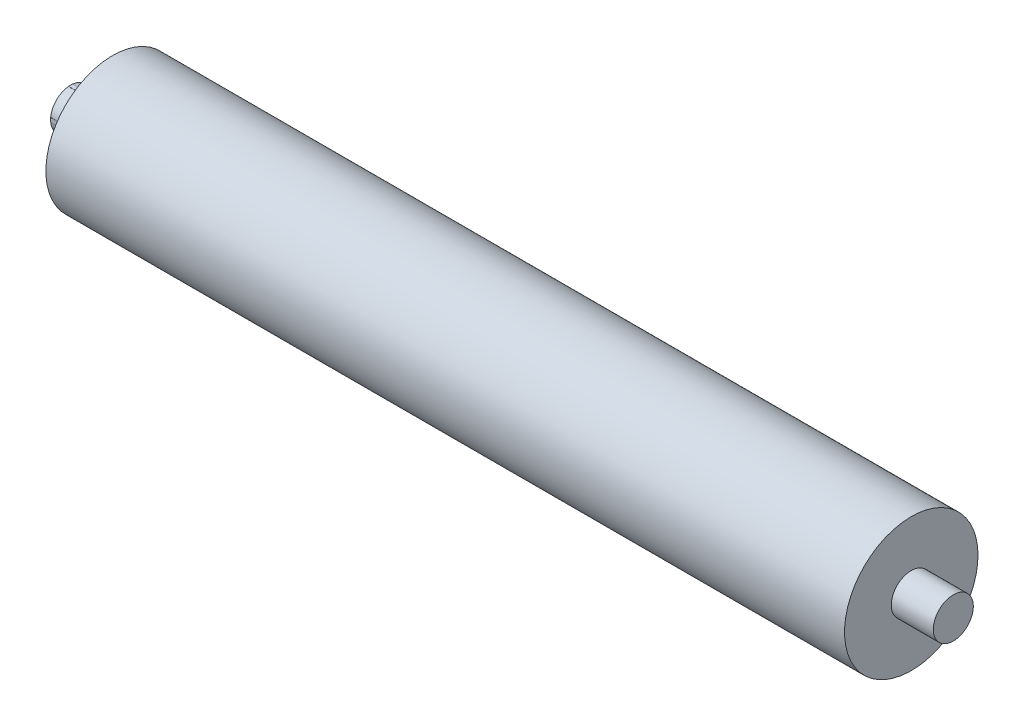
from build123d import *

# Parameters (mm, degrees)
CROQUIS1_R              = 9.525
SALIENTE_EXTRUIR1_DEPTH = 20
CROQUIS2_R              = 31.75
SALIENTE_EXTRUIR2_DEPTH = 380
CROQUIS3_R              = 9.525
SALIENTE_EXTRUIR3_DEPTH = 20
SALIENTE_EXTRUIR4_DEPTH = 20


with BuildPart() as part:
    # Croquis1 → Saliente-Extruir1 (new body)
    with BuildSketch(Plane(origin=(0, 0, 0), x_dir=(0, 0, -1), z_dir=(1, 0, 0))):
        Circle(CROQUIS1_R)
    extrude(amount=SALIENTE_EXTRUIR1_DEPTH)

    # Croquis2 → Saliente-Extruir2 (add)
    with BuildSketch(Plane(origin=(20, 0, 0), x_dir=(0, 0, -1), z_dir=(1, 0, 0))):
        Circle(CROQUIS2_R)
    extrude(amount=SALIENTE_EXTRUIR2_DEPTH)

    # Croquis3 → Saliente-Extruir3 (add)
    with BuildSketch(Plane(origin=(400, 0, 0), x_dir=(0, 0, -1), z_dir=(1, 0, 0))):
        Circle(CROQUIS3_R)
    extrude(amount=SALIENTE_EXTRUIR3_DEPTH)

    # Croquis4 → Saliente-Extruir4 (add)
    with BuildSketch(Plane.ZY):
        Polygon((0, 9.525), (-1, 9.525), (-1, 8.525), (1, 8.525), (1, 9.525), align=None)
        Polygon((9.525, 0), (9.525, 1), (8.525, 1), (8.525, -1), (9.525, -1), align=None)
    extrude(amount=-SALIENTE_EXTRUIR4_DEPTH)


solid = part.part
